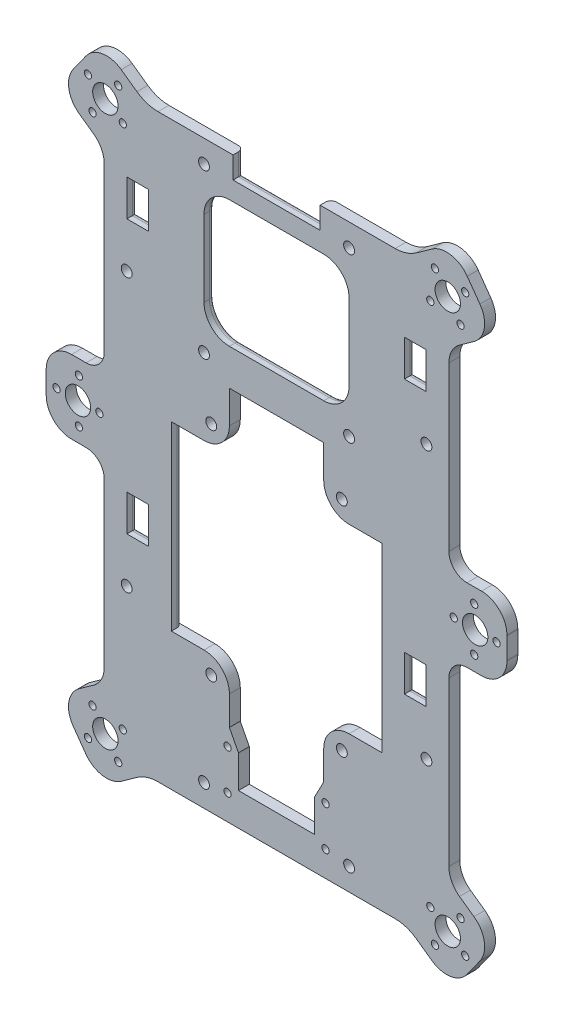
from build123d import *

# Parameters (mm, degrees)
SKETCH1_R           = 1
SKETCH1_R_2         = 3.5
SKETCH1_R_3         = 1.5
SKETCH1_W           = 6
SKETCH1_H           = 10
EXTRUDE_1_DEPTH     = 3
FILLET_1_R          = 1.5
FILLET_2_R          = 1.5
CUT_EXTRUDE_1_DEPTH = 2.6


with BuildPart() as part:
    # Sketch1 → Бобышка-Вытянуть1 (new body)
    with BuildSketch(Plane.XY):
        with BuildLine():
            Line((-24.498196466, 18.686253871), (-28.812938034, 21.763271713))
            ThreePointArc((-28.812938034, 21.763271713), (-34.033313652, 22.967935089), (-38.576502294, 20.128397731))
            Line((-38.576502294, 20.128397731), (-42.0602267, 15.24335277))
            ThreePointArc((-42.0602267, 15.24335277), (-43.264890076, 10.022977152), (-40.425352718, 5.47978851))
            Line((-40.425352718, 5.47978851), (-36.440527218, 2.638047245))
            ThreePointArc((-36.440527218, 2.638047245), (-34.281914219, 0.144259766), (-33.504872357, -3.061171876))
            Line((-33.504872357, -3.061171876), (-33.504872357, -48.061171876))
            ThreePointArc((-33.504872357, -48.061171876), (-34.969338451, -51.596705782), (-38.504872357, -53.061171876))
            Line((-38.504872357, -53.061171876), (-42.504872357, -53.061171876))
            ThreePointArc((-42.504872357, -53.061171876), (-47.454619825, -55.111424408), (-49.504872357, -60.061171876))
            Line((-49.504872357, -60.061171876), (-49.500334917, -60.235639257))
            Line((-49.500334917, -60.235639257), (-49.500334917, -66.108369799))
            Line((-49.500334917, -66.108369799), (-49.504872357, -66.28283718))
            ThreePointArc((-49.504872357, -66.28283718), (-47.454619825, -71.232584649), (-42.504872357, -73.28283718))
            Line((-42.504872357, -73.28283718), (-38.504872357, -73.28283718))
            ThreePointArc((-38.504872357, -73.28283718), (-34.969338451, -74.747303275), (-33.504872357, -78.28283718))
            Line((-33.504872357, -78.28283718), (-33.504872357, -123.28283718))
            ThreePointArc((-33.504872357, -123.28283718), (-34.281914219, -126.488268823), (-36.440527218, -128.982056301))
            Line((-36.440527218, -128.982056301), (-40.425352718, -131.823797566))
            ThreePointArc((-40.425352718, -131.823797566), (-43.264890076, -136.366986209), (-42.0602267, -141.587361827))
            Line((-42.0602267, -141.587361827), (-38.576502294, -146.472406787))
            ThreePointArc((-38.576502294, -146.472406787), (-34.033313652, -149.311944145), (-28.812938034, -148.107280769))
            Line((-28.812938034, -148.107280769), (-24.498196466, -145.030262927))
            ThreePointArc((-24.498196466, -145.030262927), (-21.740151192, -143.647892601), (-18.691989124, -143.172004528))
            Line((-18.691989124, -143.172004528), (46.687073776, -143.172004528))
            ThreePointArc((46.687073776, -143.172004528), (49.735235844, -143.647892601), (52.493281118, -145.030262927))
            Line((52.493281118, -145.030262927), (56.808022686, -148.107280769))
            ThreePointArc((56.808022686, -148.107280769), (62.028398304, -149.311944145), (66.571586947, -146.472406787))
            Line((66.571586947, -146.472406787), (70.055311352, -141.587361827))
            ThreePointArc((70.055311352, -141.587361827), (71.259974728, -136.366986209), (68.42043737, -131.823797566))
            Line((68.42043737, -131.823797566), (64.43561187, -128.982056301))
            ThreePointArc((64.43561187, -128.982056301), (62.276998871, -126.488268823), (61.499957009, -123.28283718))
            Line((61.499957009, -123.28283718), (61.499957009, -78.28283718))
            ThreePointArc((61.499957009, -78.28283718), (62.964423103, -74.747303275), (66.499957009, -73.28283718))
            Line((66.499957009, -73.28283718), (70.499957009, -73.28283718))
            ThreePointArc((70.499957009, -73.28283718), (75.449704478, -71.232584649), (77.499957009, -66.28283718))
            Line((77.499957009, -66.28283718), (77.495419569, -66.108369799))
            Line((77.495419569, -66.108369799), (77.495419569, -60.235639257))
            Line((77.495419569, -60.235639257), (77.499957009, -60.061171876))
            ThreePointArc((77.499957009, -60.061171876), (75.449704478, -55.111424407), (70.499957009, -53.061171876))
            Line((70.499957009, -53.061171876), (66.499957009, -53.061171876))
            ThreePointArc((66.499957009, -53.061171876), (62.964423103, -51.596705782), (61.499957009, -48.061171876))
            Line((61.499957009, -48.061171876), (61.499957009, -3.061171876))
            ThreePointArc((61.499957009, -3.061171876), (62.276998871, 0.144259766), (64.43561187, 2.638047245))
            Line((64.43561187, 2.638047245), (68.42043737, 5.47978851))
            ThreePointArc((68.42043737, 5.47978851), (71.259974728, 10.022977152), (70.055311352, 15.24335277))
            Line((70.055311352, 15.24335277), (66.571586947, 20.128397731))
            ThreePointArc((66.571586947, 20.128397731), (62.028398304, 22.967935089), (56.808022686, 21.763271713))
            Line((56.808022686, 21.763271713), (52.493281118, 18.686253871))
            ThreePointArc((52.493281118, 18.686253871), (49.735235844, 17.303883544), (46.687073776, 16.827995472))
            Line((46.687073776, 16.827995472), (25.997542326, 16.827995472))
            Line((25.997542326, 16.827995472), (25.997542326, 10.827995472))
            Line((25.997542326, 10.827995472), (1.997542326, 10.827995472))
            Line((1.997542326, 10.827995472), (1.997542326, 16.827995472))
            Line((1.997542326, 16.827995472), (-18.691989124, 16.827995472))
            ThreePointArc((-18.691989124, 16.827995472), (-21.740151192, 17.303883544), (-24.498196466, 18.686253871))
        make_face()
        with Locations((-37.997968141, 16.031106158)):
            Circle(SKETCH1_R, mode=Mode.SUBTRACT)
        with Locations((-29.658360325, 17.563764462)):
            Circle(SKETCH1_R, mode=Mode.SUBTRACT)
        with Locations((-36.730320867, 7.647123191)):
            Circle(SKETCH1_R, mode=Mode.SUBTRACT)
        with Locations(Location((-28.390713051, 9.179781495, 0), (0, 0, 180))):
            Circle(SKETCH1_R, mode=Mode.SUBTRACT)
        with Locations((-33.194340596, 12.605443826)):
            Circle(SKETCH1_R_2, mode=Mode.SUBTRACT)
        with Locations(Location((61.189425248, 12.605443826, 0), (0, 0, 180))):
            Circle(SKETCH1_R_2, mode=Mode.SUBTRACT)
        with Locations(Location((56.385797703, 9.179781495, 0), (0, 0, 180))):
            Circle(SKETCH1_R, mode=Mode.SUBTRACT)
        with Locations(Location((64.725405519, 7.647123191, 0), (0, 0, 180))):
            Circle(SKETCH1_R, mode=Mode.SUBTRACT)
        with Locations(Location((57.653444977, 17.563764462, 0), (0, 0, 180))):
            Circle(SKETCH1_R, mode=Mode.SUBTRACT)
        with Locations((65.993052793, 16.031106158)):
            Circle(SKETCH1_R, mode=Mode.SUBTRACT)
        with Locations((65.993052793, -142.375115215)):
            Circle(SKETCH1_R, mode=Mode.SUBTRACT)
        with Locations((57.653444977, -143.907773518)):
            Circle(SKETCH1_R, mode=Mode.SUBTRACT)
        with Locations((64.725405519, -133.991132248)):
            Circle(SKETCH1_R, mode=Mode.SUBTRACT)
        with Locations(Location((56.385797703, -135.523790551, 0), (0, 0, 180))):
            Circle(SKETCH1_R, mode=Mode.SUBTRACT)
        with Locations((61.189425248, -138.949452883)):
            Circle(SKETCH1_R_2, mode=Mode.SUBTRACT)
        with Locations(Location((-33.194340596, -138.949452883, 0), (0, 0, 180))):
            Circle(SKETCH1_R_2, mode=Mode.SUBTRACT)
        with Locations(Location((-28.390713051, -135.523790551, 0), (0, 0, 180))):
            Circle(SKETCH1_R, mode=Mode.SUBTRACT)
        with Locations(Location((-36.730320867, -133.991132248, 0), (0, 0, 180))):
            Circle(SKETCH1_R, mode=Mode.SUBTRACT)
        with Locations(Location((-29.658360325, -143.907773518, 0), (0, 0, 180))):
            Circle(SKETCH1_R, mode=Mode.SUBTRACT)
        with Locations((-37.997968141, -142.375115215)):
            Circle(SKETCH1_R, mode=Mode.SUBTRACT)
        with Locations(Location((-6.002457674, -34.362004528, 0), (0, 0, 180))):
            Circle(SKETCH1_R_3, mode=Mode.SUBTRACT)
        with Locations((55.309957009, -25.561171876)):
            Circle(SKETCH1_R_3, mode=Mode.SUBTRACT)
        with Locations((33.997542326, -136.982004528)):
            Circle(SKETCH1_R_3, mode=Mode.SUBTRACT)
        with Locations((-6.002457674, -136.982004528)):
            Circle(SKETCH1_R_3, mode=Mode.SUBTRACT)
        with Locations(Location((-6.002457674, 10.637995472, 0), (0, 0, 180))):
            Circle(SKETCH1_R_3, mode=Mode.SUBTRACT)
        with Locations(Location((33.997542326, 10.637995472, 0), (0, 0, 180))):
            Circle(SKETCH1_R_3, mode=Mode.SUBTRACT)
        with Locations(Location((33.997542326, -34.362004528, 0), (0, 0, 180))):
            Circle(SKETCH1_R_3, mode=Mode.SUBTRACT)
        with Locations(Location((31.997542326, -50.362004528, 0), (0, 0, 180))):
            Circle(SKETCH1_R_3, mode=Mode.SUBTRACT)
        with Locations(Location((-4.002457674, -50.362004528, 0), (0, 0, 180))):
            Circle(SKETCH1_R_3, mode=Mode.SUBTRACT)
        with Locations(Location((-4.002457674, -110.362004528, 0), (0, 0, 180))):
            Circle(SKETCH1_R_3, mode=Mode.SUBTRACT)
        with Locations(Location((31.997542326, -110.362004528, 0), (0, 0, 180))):
            Circle(SKETCH1_R_3, mode=Mode.SUBTRACT)
        with Locations((-27.314872357, -25.561171876)):
            Circle(SKETCH1_R_3, mode=Mode.SUBTRACT)
        with Locations((55.309957009, -100.78283718)):
            Circle(SKETCH1_R_3, mode=Mode.SUBTRACT)
        with Locations((-27.314872357, -100.78283718)):
            Circle(SKETCH1_R_3, mode=Mode.SUBTRACT)
        with Locations((27.497542326, -136.172004528)):
            Circle(SKETCH1_R, mode=Mode.SUBTRACT)
        with Locations((0.497542326, -136.172004528)):
            Circle(SKETCH1_R, mode=Mode.SUBTRACT)
        with Locations((27.497542326, -125.172004528)):
            Circle(SKETCH1_R, mode=Mode.SUBTRACT)
        with Locations((0.497542326, -125.172004528)):
            Circle(SKETCH1_R, mode=Mode.SUBTRACT)
        with Locations((-40.750334917, -63.172004528)):
            Circle(SKETCH1_R_2, mode=Mode.SUBTRACT)
        with Locations((-46.650334917, -63.172004528)):
            Circle(SKETCH1_R, mode=Mode.SUBTRACT)
        with Locations(Location((-34.850334917, -63.172004528, 0), (0, 0, 180))):
            Circle(SKETCH1_R, mode=Mode.SUBTRACT)
        with Locations((-40.487335358, -69.256322997)):
            Circle(SKETCH1_R, mode=Mode.SUBTRACT)
        with Locations(Location((-40.487335358, -57.087686059, 0), (0, 0, 180))):
            Circle(SKETCH1_R, mode=Mode.SUBTRACT)
        with Locations((68.48242001, -57.087686059)):
            Circle(SKETCH1_R, mode=Mode.SUBTRACT)
        with Locations(Location((68.48242001, -69.256322997, 0), (0, 0, 180))):
            Circle(SKETCH1_R, mode=Mode.SUBTRACT)
        with Locations((62.845419569, -63.172004528)):
            Circle(SKETCH1_R, mode=Mode.SUBTRACT)
        with Locations(Location((74.645419569, -63.172004528, 0), (0, 0, 180))):
            Circle(SKETCH1_R, mode=Mode.SUBTRACT)
        with Locations(Location((68.745419569, -63.172004528, 0), (0, 0, 180))):
            Circle(SKETCH1_R_2, mode=Mode.SUBTRACT)
        with BuildLine():
            Line((42.999957009, -55.362004528), (42.999957009, -105.362004528))
            Line((42.999957009, -105.362004528), (33.997542326, -105.362004528))
            ThreePointArc((33.997542326, -105.362004528), (29.047794858, -107.41225706), (26.997542326, -112.362004528))
            Line((26.997542326, -112.362004528), (26.997542326, -120.362004528))
            Line((26.997542326, -120.362004528), (24.497542326, -125.172004528))
            Line((24.497542326, -125.172004528), (24.497542326, -134.172004528))
            Line((24.497542326, -134.172004528), (3.497542326, -134.172004528))
            Line((3.497542326, -134.172004528), (3.497542326, -125.172004528))
            Line((3.497542326, -125.172004528), (0.997542326, -120.362004528))
            Line((0.997542326, -120.362004528), (0.997542326, -112.362004528))
            ThreePointArc((0.997542326, -112.362004528), (-1.052710206, -107.41225706), (-6.002457674, -105.362004528))
            Line((-6.002457674, -105.362004528), (-15.004872357, -105.362004528))
            Line((-15.004872357, -105.362004528), (-15.004872357, -55.362004528))
            Line((-15.004872357, -55.362004528), (-6.002457674, -55.362004528))
            ThreePointArc((-6.002457674, -55.362004528), (-1.052710206, -53.311751996), (0.997542326, -48.362004528))
            Line((0.997542326, -48.362004528), (0.997542326, -39.362004528))
            Line((0.997542326, -39.362004528), (26.997542326, -39.362004528))
            Line((26.997542326, -39.362004528), (26.997542326, -48.362004528))
            ThreePointArc((26.997542326, -48.362004528), (29.047794858, -53.311751996), (33.997542326, -55.362004528))
            Line((33.997542326, -55.362004528), (42.999957009, -55.362004528))
        make_face(mode=Mode.SUBTRACT)
        with BuildLine():
            Line((33.997542326, -1.362004528), (33.997542326, -22.362004528))
            ThreePointArc((33.997542326, -22.362004528), (31.947289794, -27.311751996), (26.997542326, -29.362004528))
            Line((26.997542326, -29.362004528), (0.997542326, -29.362004528))
            ThreePointArc((0.997542326, -29.362004528), (-3.952205142, -27.311751996), (-6.002457674, -22.362004528))
            Line((-6.002457674, -22.362004528), (-6.002457674, -1.362004528))
            ThreePointArc((-6.002457674, -1.362004528), (-3.952205142, 3.58774294), (0.997542326, 5.637995472))
            Line((0.997542326, 5.637995472), (26.997542326, 5.637995472))
            ThreePointArc((26.997542326, 5.637995472), (31.947289794, 3.58774294), (33.997542326, -1.362004528))
        make_face(mode=Mode.SUBTRACT)
        with Locations((52.249957009, -83.28283718)):
            Rectangle(SKETCH1_W, SKETCH1_H, mode=Mode.SUBTRACT)
        with Locations((-24.254872357, -83.28283718)):
            Rectangle(SKETCH1_W, SKETCH1_H, mode=Mode.SUBTRACT)
        with Locations((52.249957009, -8.061171876)):
            Rectangle(SKETCH1_W, SKETCH1_H, mode=Mode.SUBTRACT)
        with Locations((-24.254872357, -8.061171876)):
            Rectangle(SKETCH1_W, SKETCH1_H, mode=Mode.SUBTRACT)
    extrude(amount=-EXTRUDE_1_DEPTH)

    # Скругление1
    fillet_1_edges = [part.edges().sort_by_distance(p)[0] for p in [
        (55.249957009, -83.28283718, -3),
        (52.249957009, -88.28283718, -3),
        (49.249957009, -83.28283718, -3),
        (52.249957009, -78.28283718, -3),
        (-21.254872357, -83.28283718, -3),
        (-24.254872357, -88.28283718, -3),
        (-27.254872357, -83.28283718, -3),
        (-24.254872357, -78.28283718, -3),
        (52.249957009, -13.061171876, -3),
        (49.249957009, -8.061171876, -3),
        (52.249957009, -3.061171876, -3),
        (55.249957009, -8.061171876, -3),
        (-24.254872357, -13.061171876, -3),
        (-27.254872357, -8.061171876, -3),
        (-24.254872357, -3.061171876, -3),
        (-21.254872357, -8.061171876, -3),
    ]]
    fillet(fillet_1_edges, radius=FILLET_1_R)

    # Скругление2
    fillet_2_edges = [part.edges().sort_by_distance(p)[0] for p in [
        (25.997542326, 13.827995472, -3),
        (13.997542326, 10.827995472, -3),
        (1.997542326, 13.827995472, -3),
        (13.997542326, -39.362004528, -3),
        (42.999957009, -80.362004528, -3),
        (-15.004872357, -80.362004528, -3),
        (31.947289794, -27.311751996, -3),
        (13.997542326, -29.362004528, -3),
        (-3.952205142, -27.311751996, -3),
        (-6.002457674, -11.862004528, -3),
        (-3.952205142, 3.58774294, -3),
        (13.997542326, 5.637995472, -3),
        (31.947289794, 3.58774294, -3),
        (33.997542326, -11.862004528, -3),
    ]]
    fillet(fillet_2_edges, radius=FILLET_2_R)

    # Эскиз1 → Вырез-Вытянуть1 (cut)
    # profile 1 of 5: a face of its own
    with BuildSketch(Plane(origin=(0, 0, -3), x_dir=(-1, 0, 0), z_dir=(0, 0, -1))):
        Polygon((12.475963975, -21.850607929), (12.475963975, -16.714129564), (14.063463975, -16.914475117), (14.063463975, -20.347062256), (16.261540898, -20.656166823), (16.261540898, -17.191142785), (17.849040898, -17.393396391), (17.849040898, -20.879409011), (20.413463975, -21.238122953), (20.413463975, -17.715857328), (22.000963975, -17.916202881), (22.000963975, -23.186244948), align=None)
    # profile 2 of 5: a face of its own
    with BuildSketch(Plane(origin=(0, 0, -3), x_dir=(-1, 0, 0), z_dir=(0, 0, -1))):
        Polygon((12.475963975, -27.467915621), (12.475963975, -25.741127761), (20.413463975, -26.855430645), (20.413463975, -23.918937256), (22.000963975, -24.125006968), (22.000963975, -28.803552641), align=None)
    # profile 3 of 5: a face of its own
    with BuildSketch(Plane(origin=(0, 0, -3), x_dir=(-1, 0, 0), z_dir=(0, 0, -1))):
        Polygon((12.475963975, -31.13137716), (12.475963975, -29.406497352), (22.000963975, -30.742134371), (22.000963975, -32.467014179), align=None)
    # profile 4 of 5: a face of its own
    with BuildSketch(Plane(origin=(0, 0, -3), x_dir=(-1, 0, 0), z_dir=(0, 0, -1))):
        with BuildLine():
            Line((14.2122921, -34.092675237), (15.162502436, -35.60957728))
            add(Edge.make_bspline(
                [(15.162502436, -35.60957728), (15.045006395, -35.717176132), (14.820546236, -35.922729062), (14.526692614, -36.244934504), (14.29113989, -36.563295756), (14.10778446, -36.879263648), (13.977599272, -37.205859843), (13.8868042, -37.546646153), (13.829882996, -37.908159691), (13.82283757, -38.155978102), (13.819233205, -38.282759371)],
                knots=[0, 0, 0, 0, 1.232888802, 2.355265888, 3.369527809, 4.293469955, 5.174808108, 6.082472374, 7.019013217, 8, 8, 8, 8], degree=3))
            add(Edge.make_bspline(
                [(13.819233205, -38.282759371), (13.822864423, -38.420434202), (13.830001055, -38.691014168), (13.898118207, -39.085517796), (14.001054004, -39.462173443), (14.154821407, -39.816313849), (14.346060148, -40.153760134), (14.583086115, -40.469153315), (14.861151578, -40.766034235), (15.073300973, -40.941034575), (15.181582965, -41.030355525)],
                knots=[0, 0, 0, 0, 1.037173642, 2.038414783, 3.010024545, 3.97469822, 4.941265247, 5.928186508, 6.942537206, 8, 8, 8, 8], degree=3))
            add(Edge.make_bspline(
                [(15.181582965, -41.030355525), (15.272084791, -41.097461381), (15.450866842, -41.230025805), (15.735388726, -41.399239049), (16.025124893, -41.545050388), (16.322974807, -41.66458222), (16.628355081, -41.756042704), (16.941867521, -41.820638339), (17.262143516, -41.86239311), (17.478750273, -41.867387922), (17.587637653, -41.869898795)],
                knots=[0, 0, 0, 0, 1.040960542, 2.056368018, 3.055559505, 4.03710588, 5.019268411, 5.998275661, 6.99374091, 8, 8, 8, 8], degree=3))
            add(Edge.make_bspline(
                [(17.587637653, -41.869898795), (17.693962548, -41.867329468), (17.903569884, -41.862264336), (18.211267611, -41.822360359), (18.505118157, -41.75204235), (18.787354006, -41.659838175), (19.055417203, -41.536364658), (19.310514022, -41.386911419), (19.551953433, -41.210254116), (19.777723098, -41.008593428), (19.983851885, -40.787941495), (20.164521389, -40.552365763), (20.316592776, -40.304164207), (20.441117949, -40.043237304), (20.539130778, -39.769747453), (20.60710249, -39.483024083), (20.650838756, -39.184711309), (20.655387562, -38.981262402), (20.657694744, -38.878071871)],
                knots=[0, 0, 0, 0, 1.066897471, 2.103265977, 3.106535126, 4.095591644, 5.078159493, 6.062322472, 7.058152725, 8.075375883, 9.096057735, 10.084186963, 11.049730852, 12.011871914, 12.980953841, 13.959387168, 14.96498868, 16, 16, 16, 16], degree=3))
            add(Edge.make_bspline(
                [(20.657694744, -38.878071871), (20.656256081, -38.800421486), (20.653407773, -38.646686912), (20.629842062, -38.419055089), (20.591565469, -38.196589179), (20.538670313, -37.979585031), (20.469120025, -37.768065606), (20.384815242, -37.561584925), (20.286308803, -37.359573597), (20.170699378, -37.164282212), (20.041704818, -36.975397915), (19.896096707, -36.795590953), (19.734777525, -36.625264368), (19.558596871, -36.463052767), (19.368494142, -36.307896666), (19.160497619, -36.165329217), (18.93919716, -36.028983917), (18.783225408, -35.947032183), (18.70384859, -35.905325477)],
                knots=[0, 0, 0, 0, 0.990751711, 1.961520103, 2.916931976, 3.869720035, 4.809138875, 5.755683625, 6.713987145, 7.674487982, 8.649319602, 9.630449541, 10.623757948, 11.640402946, 12.684918653, 13.752145235, 14.856026455, 16, 16, 16, 16], degree=3))
            Line((18.70384859, -35.905325477), (18.70384859, -38.912416823))
            Line((18.70384859, -38.912416823), (17.11634859, -38.694898795))
            Line((17.11634859, -38.694898795), (17.11634859, -33.81028341))
            add(Edge.make_bspline(
                [(17.11634859, -33.81028341), (17.308083918, -33.82250968), (17.683030274, -33.846418656), (18.229047747, -33.932770816), (18.744373972, -34.061387188), (19.230709112, -34.226003592), (19.685869835, -34.433108204), (20.110081336, -34.680863673), (20.504943186, -34.967317472), (20.865062496, -35.294178776), (21.188091757, -35.65216784), (21.473802809, -36.034371599), (21.709762325, -36.44459237), (21.908912892, -36.874525337), (22.059054551, -37.330813343), (22.167880617, -37.809805689), (22.234076281, -38.313341905), (22.241443008, -38.65717226), (22.245194744, -38.832278602)],
                knots=[0, 0, 0, 0, 1.148919443, 2.246759443, 3.301556394, 4.323129335, 5.314115159, 6.287776434, 7.257369935, 8.227157527, 9.191570884, 10.138257605, 11.076040265, 12.017589954, 12.968137885, 13.943782171, 14.952806877, 16, 16, 16, 16], degree=3))
            add(Edge.make_bspline(
                [(22.245194744, -38.832278602), (22.244242027, -38.928346943), (22.24235987, -39.118136423), (22.223028432, -39.398381411), (22.19001621, -39.670748904), (22.146681579, -39.935081423), (22.091195267, -40.192494806), (22.023221681, -40.441845697), (21.940305727, -40.682829202), (21.8466785, -40.916826344), (21.740656272, -41.143572385), (21.619296898, -41.361245292), (21.487930553, -41.572213081), (21.342249036, -41.774067202), (21.185727339, -41.969669147), (21.015968951, -42.156104419), (20.833617386, -42.334991185), (20.704110531, -42.446817651), (20.638614215, -42.503372352)],
                knots=[0, 0, 0, 0, 1.111475163, 2.195794067, 3.248278374, 4.285131821, 5.294109109, 6.293919569, 7.273703341, 8.241249764, 9.209131986, 10.167680398, 11.123286213, 12.083161493, 13.046303771, 14.020544167, 14.998917361, 16, 16, 16, 16], degree=3))
            add(Edge.make_bspline(
                [(20.638614215, -42.503372352), (20.530042059, -42.589332559), (20.314476369, -42.760003125), (19.967181227, -42.979206113), (19.605346972, -43.165576919), (19.226875936, -43.316688516), (18.833646163, -43.43516331), (18.424377857, -43.519212932), (18.000398169, -43.569389333), (17.712432126, -43.576111219), (17.566649071, -43.579514179)],
                knots=[0, 0, 0, 0, 0.999311991, 1.984094138, 2.959667686, 3.934376172, 4.922301283, 5.921106662, 6.947558471, 8, 8, 8, 8], degree=3))
            add(Edge.make_bspline(
                [(17.566649071, -43.579514179), (17.3882825, -43.574952431), (17.036321575, -43.565950984), (16.518856506, -43.488336419), (16.018825724, -43.36761053), (15.538733279, -43.191949419), (15.07585464, -42.970203486), (14.633741397, -42.696266124), (14.207474925, -42.376772419), (13.808659745, -42.008932453), (13.440077115, -41.610026387), (13.116314367, -41.186450656), (12.843794229, -40.742290323), (12.618115304, -40.281169188), (12.4465231, -39.798685657), (12.322335583, -39.299080439), (12.245379612, -38.779967143), (12.236328282, -38.427401128), (12.231733205, -38.24841442)],
                knots=[0, 0, 0, 0, 1.022519879, 2.01768214, 2.99445506, 3.968403767, 4.944092992, 5.933246428, 6.946641619, 7.994936793, 9.040543676, 10.058341478, 11.047494914, 12.024771785, 12.997483176, 13.978673844, 14.973836105, 16, 16, 16, 16], degree=3))
            add(Edge.make_bspline(
                [(12.231733205, -38.24841442), (12.235004237, -38.114121948), (12.241515452, -37.846803522), (12.283571224, -37.448533467), (12.357608139, -37.056244407), (12.455542046, -36.670130587), (12.581288515, -36.296067214), (12.7300204, -35.937142275), (12.903846829, -35.598280796), (13.100467974, -35.274331613), (13.327941834, -34.964908718), (13.589470228, -34.664392158), (13.884900881, -34.370522479), (14.101589734, -34.18662506), (14.2122921, -34.092675237)],
                knots=[0, 0, 0, 0, 1.01418641, 2.018807989, 3.020220991, 4.026735304, 5.024640477, 5.997826472, 6.958030028, 7.89793316, 8.856694065, 9.854368027, 10.903835921, 12, 12, 12, 12], degree=3))
        make_face()
    # profile 5 of 5: a face of its own
    with BuildSketch(Plane(origin=(0, 0, -3), x_dir=(-1, 0, 0), z_dir=(0, 0, -1))):
        Polygon((12.475963975, -48.840015982), (12.475963975, -47.340286415), (22.000963975, -44.92278341), (22.000963975, -46.68200817), (19.925002436, -47.208630766), (19.925002436, -50.921701679), (22.000963975, -52.036004564), (22.000963975, -53.959321871), align=None)
        Polygon((18.337502436, -47.61504603), (15.236916499, -48.401163819), (18.337502436, -50.066893987), align=None, mode=Mode.SUBTRACT)
    extrude(amount=-CUT_EXTRUDE_1_DEPTH, mode=Mode.SUBTRACT)


solid = part.part
